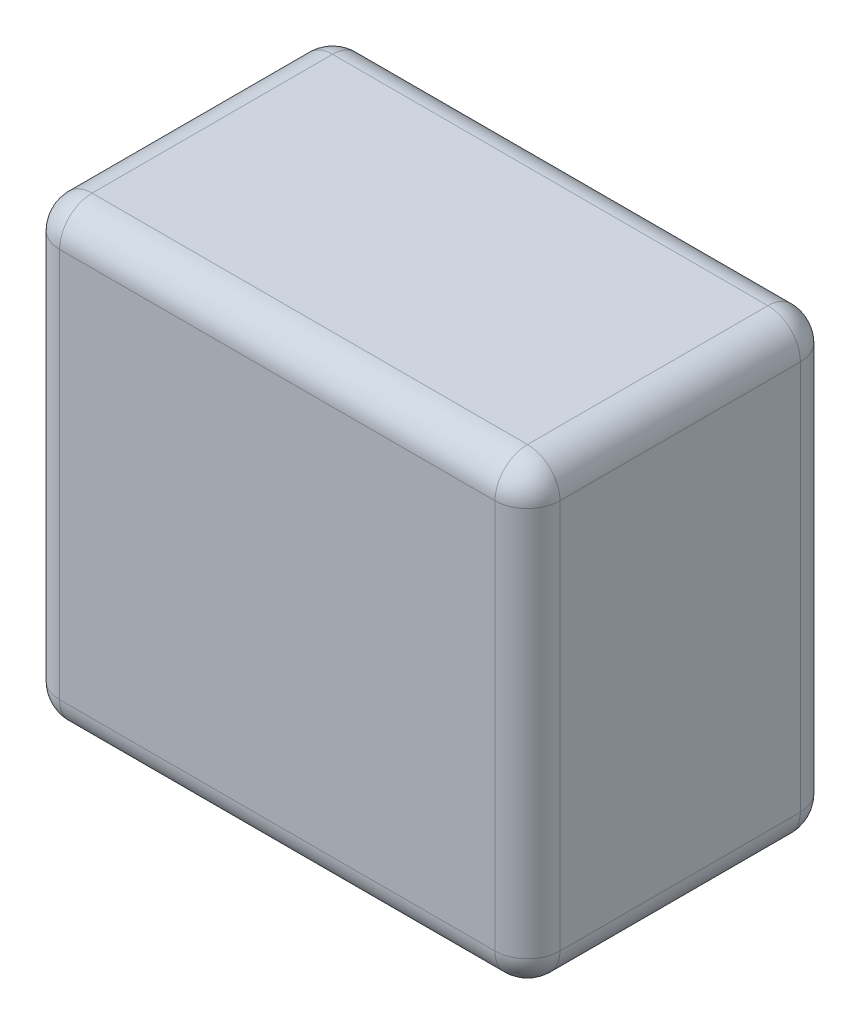
from build123d import *

# Parameters (mm, degrees)
CROQUIS1_W              = 77
CROQUIS1_H              = 70
SALIENTE_EXTRUIR1_DEPTH = 47
REDONDEO1_R             = 5


with BuildPart() as part:
    # Croquis1 → Saliente-Extruir1 (new body)
    with BuildSketch(Plane.XY):
        with Locations((38.5, 35)):
            Rectangle(CROQUIS1_W, CROQUIS1_H)
    extrude(amount=SALIENTE_EXTRUIR1_DEPTH)

    # Redondeo1
    redondeo1_edges = [part.edges().sort_by_distance(p)[0] for p in [
        (77, 35, 47),
        (38.5, 70, 47),
        (0, 35, 47),
        (38.5, 70, 0),
        (77, 35, 0),
        (38.5, 0, 0),
        (0, 35, 0),
        (38.5, 0, 47),
        (0, 70, 23.5),
        (77, 70, 23.5),
        (77, 0, 23.5),
        (0, 0, 23.5),
    ]]
    fillet(redondeo1_edges, radius=REDONDEO1_R)


solid = part.part
